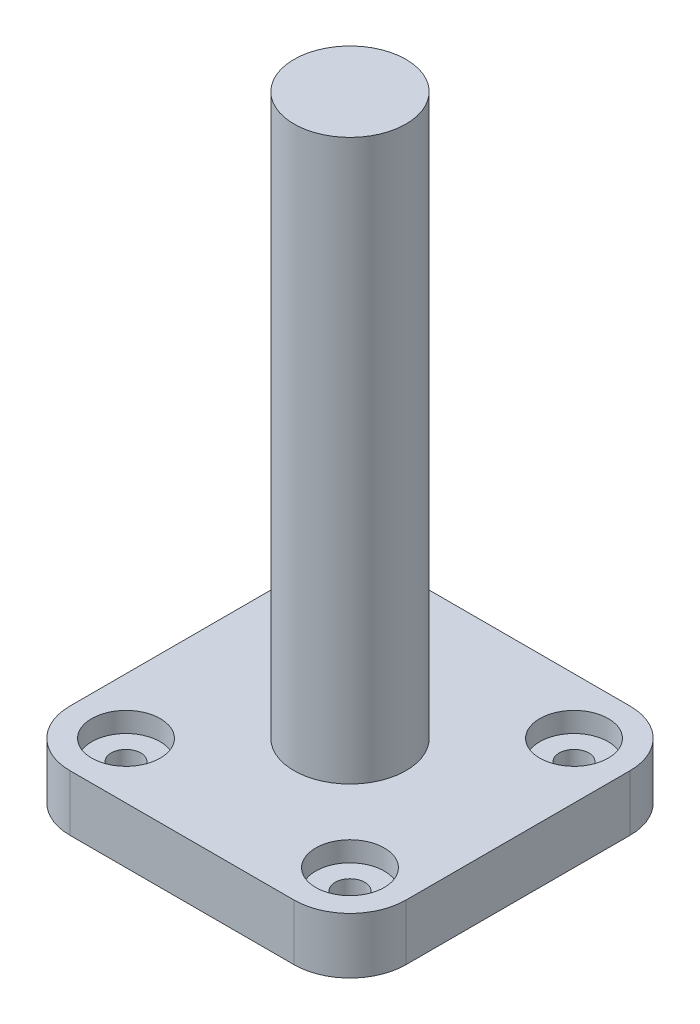
from build123d import *

# Parameters (mm, degrees)
BOSS_EXTRUDE1_DEPTH                     = 10
CBORE_FOR_M5_HEX_HEAD_BOLT1_D           = 5.3
CBORE_FOR_M5_HEX_HEAD_BOLT1_CBORE_D     = 12.24
CBORE_FOR_M5_HEX_HEAD_BOLT1_CBORE_DEPTH = 3.58
SKETCH7_R                               = 10
BOSS_EXTRUDE2_DEPTH                     = 100


with BuildPart() as part:
    # Sketch1 → Boss-Extrude1 (new body)
    with BuildSketch(Plane(origin=(0, 0, 0), x_dir=(1, 0, 0), z_dir=(0, 1, 0))):
        with BuildLine():
            Line((-20, -30), (20, -30))
            ThreePointArc((20, -30), (27.071067812, -27.071067812), (30, -20))
            Line((30, -20), (30, 20))
            ThreePointArc((30, 20), (27.071067812, 27.071067812), (20, 30))
            Line((20, 30), (-20, 30))
            ThreePointArc((-20, 30), (-27.071067812, 27.071067812), (-30, 20))
            Line((-30, 20), (-30, -20))
            ThreePointArc((-30, -20), (-27.071067812, -27.071067812), (-20, -30))
        make_face()
    extrude(amount=BOSS_EXTRUDE1_DEPTH)

    # CBORE for M5 Hex Head Bolt1 (through all)
    with Locations(Plane(origin=(0, 10, 0), x_dir=(1, 0, 0), z_dir=(0, 1, 0))):
        with Locations((-20, -20), (-20, 20), (20, 20), (20, -20)):
            CounterBoreHole(CBORE_FOR_M5_HEX_HEAD_BOLT1_D / 2, CBORE_FOR_M5_HEX_HEAD_BOLT1_CBORE_D / 2, CBORE_FOR_M5_HEX_HEAD_BOLT1_CBORE_DEPTH)

    # Sketch7 → Boss-Extrude2 (add)
    with BuildSketch(Plane(origin=(0, 10, 0), x_dir=(1, 0, 0), z_dir=(0, 1, 0))):
        with Locations(Location((0, 0, 0), (0, 0, 90))):
            Circle(SKETCH7_R)
    extrude(amount=BOSS_EXTRUDE2_DEPTH)


solid = part.part
